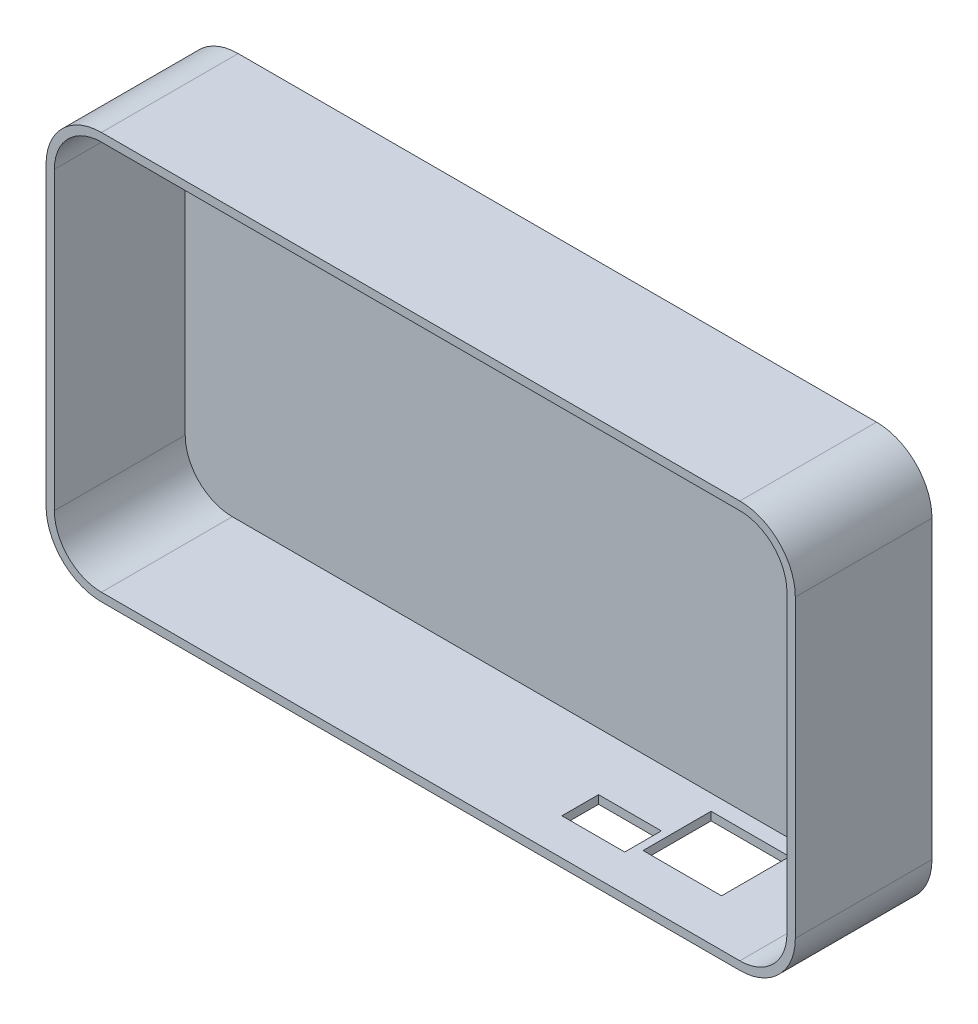
from build123d import *

# Parameters (mm, degrees)
PARED_DEPTH       = 25
CONECTORES_REACH  = 165.441
CROQUIS2_W        = 15
CROQUIS2_H        = 13
CROQUIS2_W_2      = 12
CROQUIS2_H_2      = 7
BASE_START        = -1.12
BASE_FRENTE_DEPTH = 1.12
LUCES_REACH       = 164.686
CROQUIS3_W        = 2
CROQUIS3_H        = 5.5


with BuildPart() as part:
    # Croquis1 → pared (new body)
    with BuildSketch(Plane.XY):
        with BuildLine():
            Line((9, 76.1), (131, 76.1))
            ThreePointArc((131, 76.1), (138.495331881, 72.995331881), (141.6, 65.5))
            Line((141.6, 65.5), (141.6, 9))
            ThreePointArc((141.6, 9), (138.495331881, 1.504668119), (131, -1.6))
            Line((131, -1.6), (9, -1.6))
            ThreePointArc((9, -1.6), (1.504668119, 1.504668119), (-1.6, 9))
            Line((-1.6, 9), (-1.6, 65.5))
            ThreePointArc((-1.6, 65.5), (1.504668119, 72.995331881), (9, 76.1))
        make_face()
        with BuildLine():
            Line((9, 0), (131, 0))
            ThreePointArc((131, 0), (137.363961031, 2.636038969), (140, 9))
            Line((140, 9), (140, 65.5))
            ThreePointArc((140, 65.5), (137.363961031, 71.863961031), (131, 74.5))
            Line((131, 74.5), (9, 74.5))
            ThreePointArc((9, 74.5), (2.636038969, 71.863961031), (0, 65.5))
            Line((0, 65.5), (0, 9))
            ThreePointArc((0, 9), (2.636038969, 2.636038969), (9, 0))
        make_face(mode=Mode.SUBTRACT)
    extrude(amount=PARED_DEPTH)

    # Croquis2 → conectores (cut, up to next)
    with BuildSketch(Plane.XZ.offset(1.6), mode=Mode.PRIVATE) as conectores_sk1:
        with Locations((111, 9.5)):
            Rectangle(CROQUIS2_W, CROQUIS2_H)
    conectores_tool1 = extrude(conectores_sk1.sketch, amount=-CONECTORES_REACH, mode=Mode.PRIVATE) & part.part
    # Croquis2 → conectores (cut, up to next)
    with BuildSketch(Plane.XZ.offset(1.6), mode=Mode.PRIVATE) as conectores_sk2:
        with Locations((96, 14.5)):
            Rectangle(CROQUIS2_W_2, CROQUIS2_H_2)
    conectores_tool2 = extrude(conectores_sk2.sketch, amount=-CONECTORES_REACH, mode=Mode.PRIVATE) & part.part
    add(conectores_tool1.solids().sort_by_distance((111, -1.6, 9.5))[0], mode=Mode.SUBTRACT)
    add(conectores_tool2.solids().sort_by_distance((96, -1.6, 14.5))[0], mode=Mode.SUBTRACT)

    # Croquis1<2> → base frente (add)
    with BuildSketch(Plane.XY.offset(BASE_START)):
        with BuildLine():
            Line((9, 76.1), (131, 76.1))
            ThreePointArc((131, 76.1), (138.495331881, 72.995331881), (141.6, 65.5))
            Line((141.6, 65.5), (141.6, 9))
            ThreePointArc((141.6, 9), (138.495331881, 1.504668119), (131, -1.6))
            Line((131, -1.6), (9, -1.6))
            ThreePointArc((9, -1.6), (1.504668119, 1.504668119), (-1.6, 9))
            Line((-1.6, 9), (-1.6, 65.5))
            ThreePointArc((-1.6, 65.5), (1.504668119, 72.995331881), (9, 76.1))
        make_face()
    extrude(amount=BASE_FRENTE_DEPTH)

    # Croquis3 → luces (cut, up to next)
    with BuildSketch(Plane.XY, mode=Mode.PRIVATE) as luces_sk1:
        with Locations((132, 38.25)):
            Rectangle(CROQUIS3_W, CROQUIS3_H)
    luces_tool1 = extrude(luces_sk1.sketch, amount=-LUCES_REACH, mode=Mode.PRIVATE) & part.part
    # Croquis3 → luces (cut, up to next)
    with BuildSketch(Plane.XY, mode=Mode.PRIVATE) as luces_sk2:
        with BuildLine():
            Line((133, 34.5), (131, 34.5))
            Line((131, 34.5), (131, 29.5))
            ThreePointArc((131, 29.5), (131.146446609, 29.146446609), (131.5, 29))
            Line((131.5, 29), (132.5, 29))
            ThreePointArc((132.5, 29), (132.853553391, 29.146446609), (133, 29.5))
            Line((133, 29.5), (133, 34.5))
        make_face()
    luces_tool2 = extrude(luces_sk2.sketch, amount=-LUCES_REACH, mode=Mode.PRIVATE) & part.part
    # Croquis3 → luces (cut, up to next)
    with BuildSketch(Plane.XY, mode=Mode.PRIVATE) as luces_sk3:
        with Locations((132, 44.75)):
            Rectangle(CROQUIS3_W, CROQUIS3_H)
    luces_tool3 = extrude(luces_sk3.sketch, amount=-LUCES_REACH, mode=Mode.PRIVATE) & part.part
    # Croquis3 → luces (cut, up to next)
    with BuildSketch(Plane.XY, mode=Mode.PRIVATE) as luces_sk4:
        with BuildLine():
            Line((131, 53.5), (131, 48.5))
            Line((131, 48.5), (133, 48.5))
            Line((133, 48.5), (133, 53.5))
            ThreePointArc((133, 53.5), (132.853553391, 53.853553391), (132.5, 54))
            Line((132.5, 54), (131.5, 54))
            ThreePointArc((131.5, 54), (131.146446609, 53.853553391), (131, 53.5))
        make_face()
    luces_tool4 = extrude(luces_sk4.sketch, amount=-LUCES_REACH, mode=Mode.PRIVATE) & part.part
    # Croquis3 → luces (cut, up to next)
    with BuildSketch(Plane.XY, mode=Mode.PRIVATE) as luces_sk5:
        with BuildLine():
            Line((132.5, 28), (131.5, 28))
            ThreePointArc((131.5, 28), (131.146446609, 27.853553391), (131, 27.5))
            Line((131, 27.5), (131, 13.5))
            ThreePointArc((131, 13.5), (131.146446609, 13.146446609), (131.5, 13))
            Line((131.5, 13), (132.5, 13))
            ThreePointArc((132.5, 13), (132.853553391, 13.146446609), (133, 13.5))
            Line((133, 13.5), (133, 27.5))
            ThreePointArc((133, 27.5), (132.853553391, 27.853553391), (132.5, 28))
        make_face()
    luces_tool5 = extrude(luces_sk5.sketch, amount=-LUCES_REACH, mode=Mode.PRIVATE) & part.part
    add(luces_tool1.solids().sort_by_distance((132, 38.25, 0))[0], mode=Mode.SUBTRACT)
    add(luces_tool2.solids().sort_by_distance((132, 31.775989, 0))[0], mode=Mode.SUBTRACT)
    add(luces_tool3.solids().sort_by_distance((132, 44.75, 0))[0], mode=Mode.SUBTRACT)
    add(luces_tool4.solids().sort_by_distance((132, 51.224011, 0))[0], mode=Mode.SUBTRACT)
    add(luces_tool5.solids().sort_by_distance((132, 20.5, 0))[0], mode=Mode.SUBTRACT)


solid = part.part
